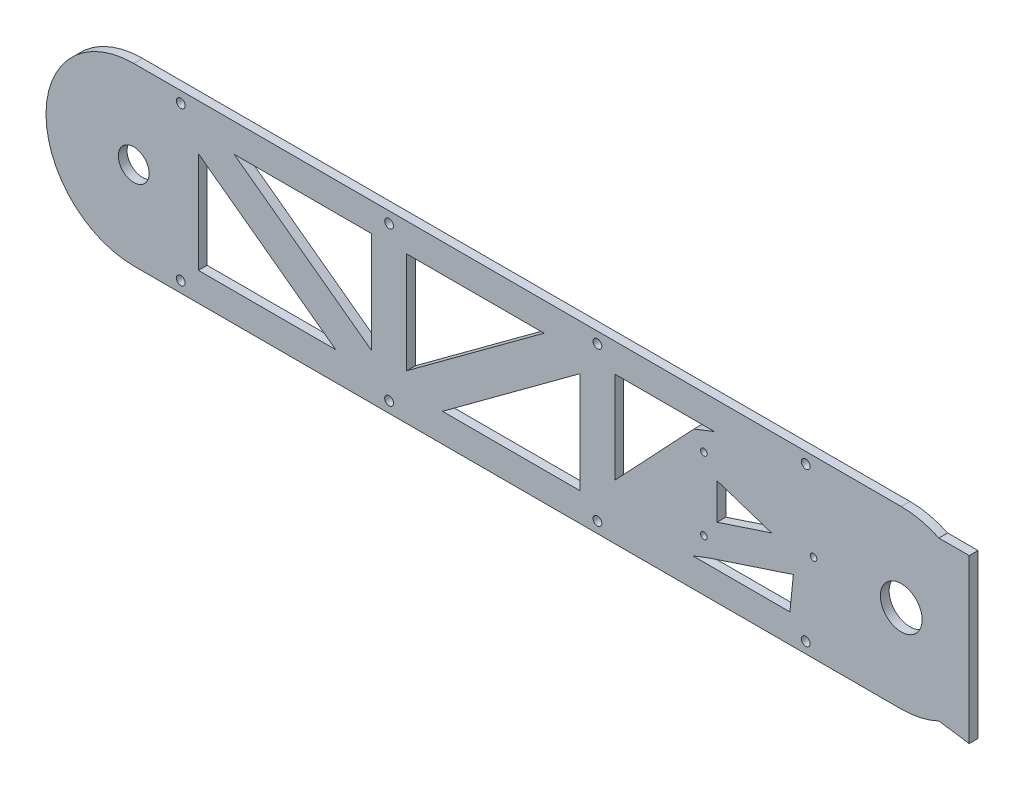
from build123d import *

# Parameters (mm, degrees)
SKETCH_1_R          = 7.03
SKETCH_1_R_2        = 1.5
SKETCH_1_R_3        = 9.53
EXTRUDE_1_DEPTH     = 4
SKETCH_2_R          = 2
CUT_EXTRUDE_1_DEPTH = 10
CUT_EXTRUDE_4_DEPTH = 4
EXTRUDE_2_DEPTH     = 4


with BuildPart() as part:
    # 草图1 → 凸台-拉伸1 (new body)
    with BuildSketch(Plane.XY):
        with BuildLine():
            ThreePointArc((348.542857143, -40.145714286), (388.542857143, -0.145714286), (348.542857143, 39.854285714))
            Line((348.542857143, 39.854285714), (-1.457142857, 39.854285714))
            ThreePointArc((-1.457142857, 39.854285714), (-41.457142857, -0.145714286), (-1.457142857, -40.145714286))
            Line((-1.457142857, -40.145714286), (348.542857143, -40.145714286))
        make_face()
        with Locations((-1.457142857, -0.145714286)):
            Circle(SKETCH_1_R, mode=Mode.SUBTRACT)
        with Locations((258.542857143, -16.645714286)):
            Circle(SKETCH_1_R_2, mode=Mode.SUBTRACT)
        with Locations((258.542857143, 16.354285714)):
            Circle(SKETCH_1_R_2, mode=Mode.SUBTRACT)
        with Locations((308.542857143, -0.145714286)):
            Circle(SKETCH_1_R_2, mode=Mode.SUBTRACT)
        with Locations((348.542857143, -0.145714286)):
            Circle(SKETCH_1_R_3, mode=Mode.SUBTRACT)
    extrude(amount=EXTRUDE_1_DEPTH)

    # 草图2 → 切除-拉伸1 (cut)
    with BuildSketch(Plane.XY.offset(4)):
        Polygon((107, 26.854285714), (44.343341396, 26.854285714), (107, -19.31377852), align=None)
        Polygon((90.656658604, -27.145714286), (28, 19.022349949), (28, -27.145714286), align=None)
        with Locations((210, 34.854285714)):
            Circle(SKETCH_2_R)
        with Locations((115, -35.145714286)):
            Circle(SKETCH_2_R)
        Polygon((202, 19.022349949), (139.343341396, -27.145714286), (202, -27.145714286), align=None)
        Polygon((185.656658604, 26.854285714), (123, 26.854285714), (123, -19.31377852), align=None)
        Polygon((263.286571323, 26.854285714), (218, 26.854285714), (218, -14.994963043), (253.936816603, 23.131059281), align=None)
        Polygon((297.768914783, -27.145714286), (299.341875576, -11.606383875), (261.222229771, -24.18586699), (253.455773316, -27.145714286), align=None)
        Polygon((264.542857143, -8.347455032), (289.396616979, -0.145714286), (264.542857143, 8.05602646), align=None)
        with Locations((20, 34.854285714)):
            Circle(SKETCH_2_R)
        with Locations((115, 34.854285714)):
            Circle(SKETCH_2_R)
        with Locations((305, 34.854285714)):
            Circle(SKETCH_2_R)
        with Locations((305, -35.145714286)):
            Circle(SKETCH_2_R)
        with Locations((210, -35.145714286)):
            Circle(SKETCH_2_R)
        with Locations((20, -35.145714286)):
            Circle(SKETCH_2_R)
    extrude(amount=-CUT_EXTRUDE_1_DEPTH, mode=Mode.SUBTRACT)

    # 草图3 → 切除-拉伸4 (cut)
    with BuildSketch(Plane(origin=(0, 0, 0), x_dir=(-1, 0, 0), z_dir=(0, 0, -1))):
        Polygon((-379.542857143, -0.145714286), (-379.542857143, 86.711362621), (-469.13936256, 65.161980464), (-431.797169727, -71.622846313), (-379.542857143, -46.898899995), align=None)
    extrude(amount=-CUT_EXTRUDE_4_DEPTH, mode=Mode.SUBTRACT)

    # 草图4 → 凸台-拉伸2 (add)
    with BuildSketch(Plane(origin=(0, 0, 0), x_dir=(-1, 0, 0), z_dir=(0, 0, -1))):
        Polygon((-379.542857143, -25.424163605), (-379.542857143, -38.278889608), (-365.701849351, -36.278372455), (-365.701849351, 35.986943884), (-379.542857143, 35.986943884), (-379.542857143, 25.132735034), align=None)
    extrude(amount=-EXTRUDE_2_DEPTH)


solid = part.part
